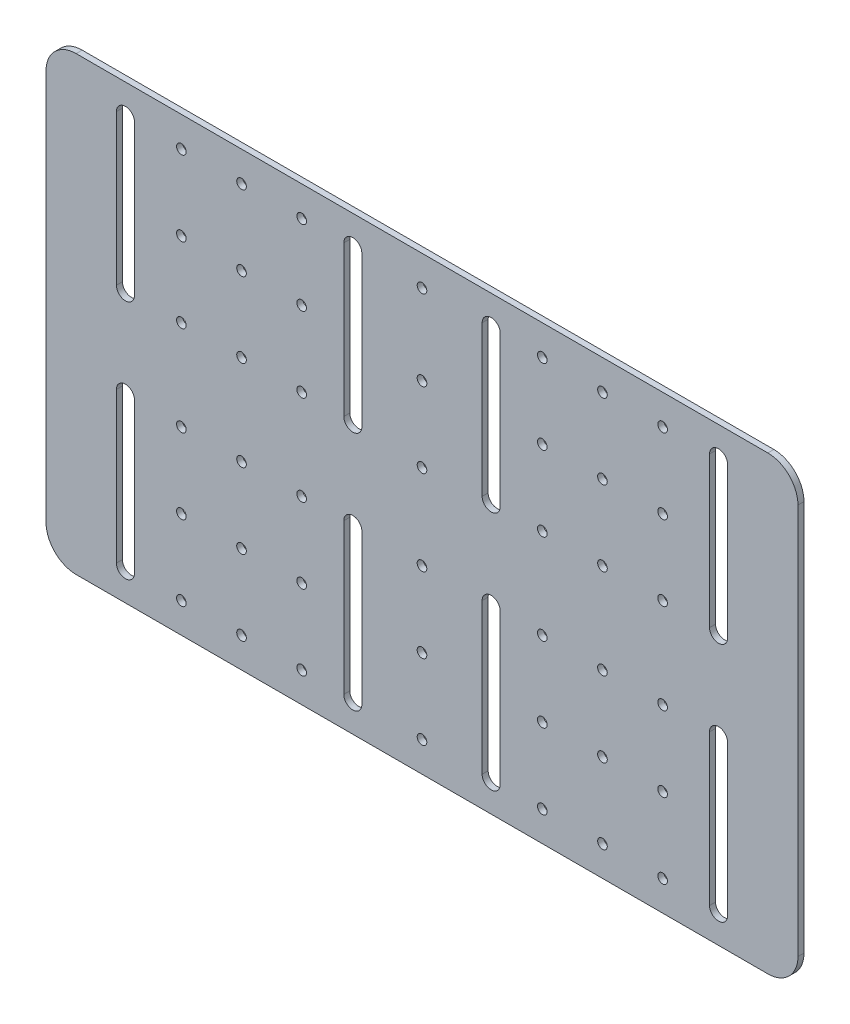
from build123d import *

# Parameters (mm, degrees)
SKETCH1_W                                = 250
SKETCH1_H                                = 150
BOSS_EXTRUDE1_DEPTH                      = 2
SKETCH2_R                                = 1.6
CUT_EXTRUDE1_DEPTH                       = 2
CUT_EXTRUDE2_DEPTH                       = 2
SKETCH10_R                               = 1.6
CUT_EXTRUDE7_DEPTH                       = 292.554454605
CUT_EXTRUDE8_DEPTH                       = 292.554454605
MIRROR5_AT_THE_SECOND_PLANE_COPY_1_DEPTH = 292.554454605
FILLET1_R                                = 10


with BuildPart() as part:
    # Sketch1 → Boss-Extrude1 (new body)
    with BuildSketch(Plane.XY):
        with Locations((125, 75)):
            Rectangle(SKETCH1_W, SKETCH1_H)
    extrude(amount=BOSS_EXTRUDE1_DEPTH)

    # Sketch2 → Cut-Extrude1 (cut)
    with BuildSketch(Plane.XY.offset(2)):
        with Locations((25, 140)):
            Circle(SKETCH2_R)
        with Locations((45, 140)):
            Circle(SKETCH2_R)
        with Locations((45, 115)):
            Circle(SKETCH2_R)
        with Locations((45, 90)):
            Circle(SKETCH2_R)
        with Locations((25, 115)):
            Circle(SKETCH2_R)
        with Locations((25, 90)):
            Circle(SKETCH2_R)
        with Locations((65, 140)):
            Circle(SKETCH2_R)
        with Locations((65, 115)):
            Circle(SKETCH2_R)
        with Locations((65, 90)):
            Circle(SKETCH2_R)
        with Locations((85, 140)):
            Circle(SKETCH2_R)
        with Locations((85, 115)):
            Circle(SKETCH2_R)
        with Locations((85, 90)):
            Circle(SKETCH2_R)
        with Locations(Location((165, 90, 0), (0, 0, 180))):
            Circle(SKETCH2_R)
        with Locations(Location((185, 90, 0), (0, 0, 180))):
            Circle(SKETCH2_R)
        with Locations(Location((205, 90, 0), (0, 0, 180))):
            Circle(SKETCH2_R)
        with Locations(Location((225, 90, 0), (0, 0, 180))):
            Circle(SKETCH2_R)
        with Locations(Location((225, 115, 0), (0, 0, 180))):
            Circle(SKETCH2_R)
        with Locations(Location((205, 115, 0), (0, 0, 180))):
            Circle(SKETCH2_R)
        with Locations(Location((185, 115, 0), (0, 0, 180))):
            Circle(SKETCH2_R)
        with Locations(Location((165, 115, 0), (0, 0, 180))):
            Circle(SKETCH2_R)
        with Locations(Location((165, 140, 0), (0, 0, 180))):
            Circle(SKETCH2_R)
        with Locations(Location((185, 140, 0), (0, 0, 180))):
            Circle(SKETCH2_R)
        with Locations(Location((205, 140, 0), (0, 0, 180))):
            Circle(SKETCH2_R)
        with Locations(Location((225, 140, 0), (0, 0, 180))):
            Circle(SKETCH2_R)
    cut_extrude1 = extrude(amount=-CUT_EXTRUDE1_DEPTH, mode=Mode.SUBTRACT)

    # Mirror1: Cut-Extrude1 across plane
    add(cut_extrude1.mirror(Plane(origin=(0, 75, 0), x_dir=(0, 0, 1), z_dir=(0, -1, 0))), mode=Mode.SUBTRACT)

    # Sketch5 → Cut-Extrude2 (cut)
    with BuildSketch(Plane.XY.offset(2)):
        with BuildLine():
            Line((23.4, 140), (23.4, 90))
            ThreePointArc((23.4, 90), (26.4, 87), (29.4, 90))
            Line((29.4, 90), (29.4, 140))
            ThreePointArc((29.4, 140), (26.4, 143), (23.4, 140))
        make_face()
        with BuildLine():
            Line((29.4, 10), (29.4, 60))
            ThreePointArc((29.4, 60), (26.4, 63), (23.4, 60))
            Line((23.4, 60), (23.4, 10))
            ThreePointArc((23.4, 10), (26.4, 7), (29.4, 10))
        make_face()
        with BuildLine():
            Line((226.6, 10), (226.6, 60))
            ThreePointArc((226.6, 60), (223.6, 63), (220.6, 60))
            Line((220.6, 60), (220.6, 10))
            ThreePointArc((220.6, 10), (223.6, 7), (226.6, 10))
        make_face()
        with BuildLine():
            Line((226.6, 140), (226.6, 90))
            ThreePointArc((226.6, 90), (223.6, 87), (220.6, 90))
            Line((220.6, 90), (220.6, 140))
            ThreePointArc((220.6, 140), (223.6, 143), (226.6, 140))
        make_face()
    extrude(amount=-CUT_EXTRUDE2_DEPTH, mode=Mode.SUBTRACT)

    # Sketch10 → Cut-Extrude7 (cut, through all)
    with BuildSketch(Plane.XY.offset(2)):
        with Locations((125, 140)):
            Circle(SKETCH10_R)
        with Locations((125, 35)):
            Circle(SKETCH10_R)
        with Locations((125, 60)):
            Circle(SKETCH10_R)
        with Locations((125, 88.292351152)):
            Circle(SKETCH10_R)
        with Locations((125, 113.292351152)):
            Circle(SKETCH10_R)
        with Locations((125, 10)):
            Circle(SKETCH10_R)
    extrude(amount=-CUT_EXTRUDE7_DEPTH, mode=Mode.SUBTRACT)

    # Sketch11 → Cut-Extrude8 (cut, through all)
    with BuildSketch(Plane.XY.offset(2)):
        with BuildLine():
            Line((99, 140), (99, 90))
            ThreePointArc((99, 90), (102, 87), (105, 90))
            Line((105, 90), (105, 140))
            ThreePointArc((105, 140), (102, 143), (99, 140))
        make_face()
    cut_extrude8 = extrude(amount=-CUT_EXTRUDE8_DEPTH, mode=Mode.SUBTRACT)

    # Mirror5: Cut-Extrude8 across plane
    add(cut_extrude8.mirror(Plane(origin=(0, 75, 0), x_dir=(0, 0, 1), z_dir=(0, -1, 0))), mode=Mode.SUBTRACT)

    # Mirror5 at the second plane: Cut-Extrude8 across plane
    add(cut_extrude8.mirror(Plane.ZY.offset(-125)), mode=Mode.SUBTRACT)

    # Mirror5 at the second plane copy 1 sketc → Mirror5 at the second plane copy 1 (cut, through all)
    with BuildSketch(Plane(origin=(250, 150, 2), x_dir=(-1, 0, 0), z_dir=(0, 0, 1))):
        with BuildLine():
            Line((99, 140), (99, 90))
            ThreePointArc((99, 90), (102, 87), (105, 90))
            Line((105, 90), (105, 140))
            ThreePointArc((105, 140), (102, 143), (99, 140))
        make_face()
    extrude(amount=-MIRROR5_AT_THE_SECOND_PLANE_COPY_1_DEPTH, mode=Mode.SUBTRACT)

    # Fillet1
    fillet1_edges = [part.edges().sort_by_distance(p)[0] for p in [
        (0, 150, 1),
        (250, 150, 1),
        (250, 0, 1),
        (0, 0, 1),
    ]]
    fillet(fillet1_edges, radius=FILLET1_R)


solid = part.part
